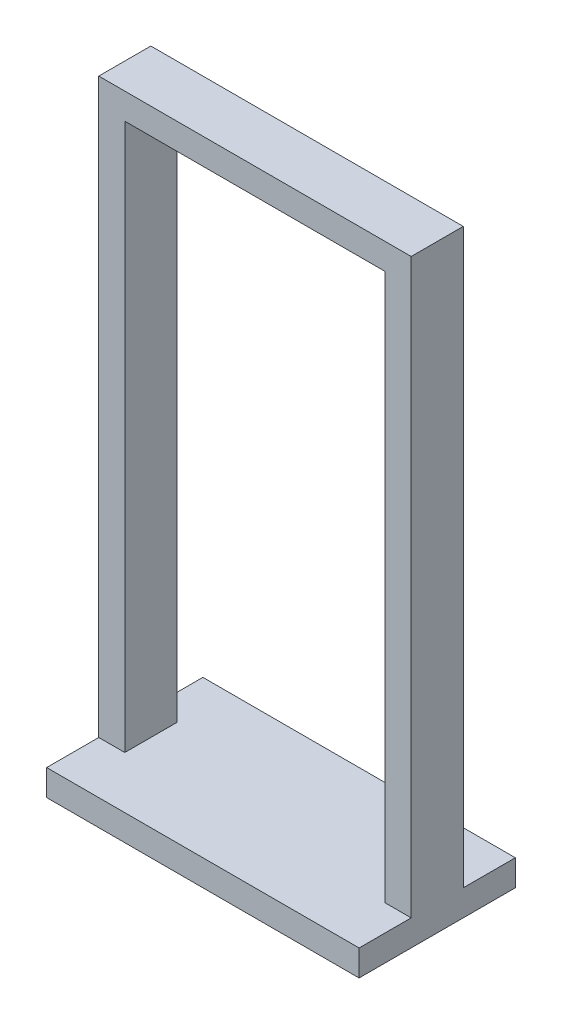
from build123d import *

# Parameters (mm, degrees)
ESBO_O1_W                     = 1200
ESBO_O1_H                     = 2300
ESBO_O1_W_2                   = 1000
ESBO_O1_H_2                   = 2100
EXTRUS_O_FINA1_DEPTH          = 100
RESSALTO_EXTRUS_O1_DEPTH      = 200
RESSALTO_EXTRUS_O1_DEPTH_BACK = 400
ESBO_O2_W                     = 1200
ESBO_O2_H                     = 100
ESBO_O3_W                     = 70
ESBO_O3_H                     = 17
CORTE_EXTRUS_O1_DEPTH         = 30


with BuildPart() as part:
    # Esboço1 → Extrusão-Fina1 (new, symmetric)
    with BuildSketch(Plane.XY):
        Rectangle(ESBO_O1_W, ESBO_O1_H)
        Rectangle(ESBO_O1_W_2, ESBO_O1_H_2, mode=Mode.SUBTRACT)
    extrude(amount=EXTRUS_O_FINA1_DEPTH, both=True)

    # Esboço2 → Ressalto-extrusão1 (add, two sides: drawn at the far end of the back side and taken through both)
    with BuildSketch(Plane.XY.offset(100).offset(-RESSALTO_EXTRUS_O1_DEPTH_BACK)):
        with Locations((0, -1100)):
            Rectangle(ESBO_O2_W, ESBO_O2_H)
    extrude(amount=RESSALTO_EXTRUS_O1_DEPTH + RESSALTO_EXTRUS_O1_DEPTH_BACK)

    # Esboço3 → Corte-extrusão1 (cut)
    with BuildSketch(Plane.XZ.offset(-1050)):
        with Locations((320, 74)):
            Rectangle(ESBO_O3_W, ESBO_O3_H)
    extrude(amount=-CORTE_EXTRUS_O1_DEPTH, mode=Mode.SUBTRACT)


solid = part.part
